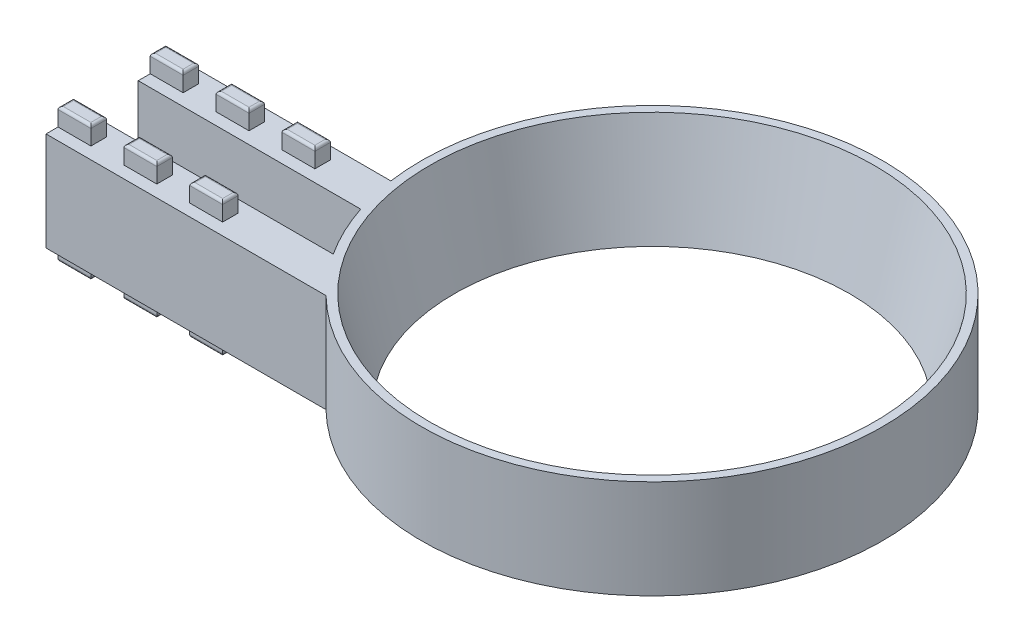
from build123d import *

# Parameters (mm, degrees)
SKETCH1_R            = 44.45
BOSS_EXTRUDE1_DEPTH  = 19.05
BOSS_EXTRUDE2_DEPTH  = 3.175
SKETCH4_W            = 53.981480267
SKETCH4_H            = 15.875
BOSS_EXTRUDE3_DEPTH  = 7.62
SKETCH5_W            = 53.981480267
SKETCH5_H            = 15.875
BOSS_EXTRUDE4_DEPTH  = 7.62
SKETCH2_R            = 38.1
CUT_EXTRUDE1_DEPTH   = 98.872432789
CUT_EXTRUDE1_DRAFT   = 14
SKETCH6_W            = 6.35
SKETCH6_H            = 2.9972
BOSS_EXTRUDE5_DEPTH  = 3.429
FILLET1_R            = 0.508
FILLET1_OF_MIRROR1_R = 0.508


with BuildPart() as part:
    # Sketch1 → Boss-Extrude1 (new body)
    with BuildSketch(Plane(origin=(0, 0, 0), x_dir=(1, 0, 0), z_dir=(0, 1, 0))):
        with Locations(Location((0, 0, 0), (0, 0, 90))):
            Circle(SKETCH1_R)
    extrude(amount=BOSS_EXTRUDE1_DEPTH)

    # Sketch3 → Boss-Extrude2 (add)
    with BuildSketch(Plane.XZ):
        with BuildLine():
            Line((-31.108519733, 31.75), (-85.09, 31.75))
            Line((-85.09, 31.75), (-85.09, 6.35))
            Line((-85.09, 6.35), (-43.994090512, 6.35))
            ThreePointArc((-43.994090512, 6.35), (-39.640768363, 20.109997105), (-31.108519733, 31.75))
        make_face()
    extrude(amount=-BOSS_EXTRUDE2_DEPTH)

    # Sketch4 → Boss-Extrude3 (add)
    with BuildSketch(Plane.XY.offset(31.75)):
        with Locations((-58.099259867, 11.1125)):
            Rectangle(SKETCH4_W, SKETCH4_H)
    extrude(amount=-BOSS_EXTRUDE3_DEPTH)

    # Sketch5 → Boss-Extrude4 (add)
    with BuildSketch(Plane(origin=(0, 0, 6.35), x_dir=(-1, 0, 0), z_dir=(0, 0, -1))):
        with Locations((58.099259867, 11.1125)):
            Rectangle(SKETCH5_W, SKETCH5_H)
    extrude(amount=-BOSS_EXTRUDE4_DEPTH)


with BuildPart() as cut_extrude1_tool:
    # Sketch2 → Cut-Extrude1 (with draft: the straight prism first)
    with BuildSketch(Plane.XZ):
        Circle(SKETCH2_R)
    extrude(amount=-CUT_EXTRUDE1_DEPTH)
    # Cut-Extrude1: the draft: its side faces are tilted about the plane it starts from
    cut_extrude1_sides = [cut_extrude1_tool.faces().sort_by_distance(p)[0] for p in [
        (-38.1, 49.436216394, 0),
    ]]
    draft(cut_extrude1_sides, Plane.XZ, CUT_EXTRUDE1_DRAFT)


with BuildPart() as part_1:
    add(part.part)

    # Cut-Extrude1: cut by cut_extrude1_tool
    add(cut_extrude1_tool.part, mode=Mode.SUBTRACT)

    # Sketch6 → Boss-Extrude5 (add)
    with BuildSketch(Plane(origin=(0, 19.05, 0), x_dir=(1, 0, 0), z_dir=(0, 1, 0))):
        with Locations((-81.915, -27.94)):
            Rectangle(SKETCH6_W, SKETCH6_H)
        with Locations((-69.215, -27.94)):
            Rectangle(SKETCH6_W, SKETCH6_H)
        with Locations((-56.515, -27.94)):
            Rectangle(SKETCH6_W, SKETCH6_H)
        with Locations((-56.515, -10.16)):
            Rectangle(SKETCH6_W, SKETCH6_H)
        with Locations((-69.215, -10.16)):
            Rectangle(SKETCH6_W, SKETCH6_H)
        with Locations((-81.915, -10.16)):
            Rectangle(SKETCH6_W, SKETCH6_H)
    boss_extrude5 = extrude(amount=BOSS_EXTRUDE5_DEPTH)

    # Fillet1
    fillet1_edges = [part_1.edges().sort_by_distance(p)[0] for p in [
        (-69.215, 22.479, 29.4386),
        (-66.04, 22.479, 27.94),
        (-69.215, 22.479, 26.4414),
        (-72.39, 22.479, 27.94),
        (-85.09, 22.479, 27.94),
        (-81.915, 22.479, 29.4386),
        (-78.74, 22.479, 27.94),
        (-81.915, 22.479, 26.4414),
        (-85.09, 22.479, 10.16),
        (-81.915, 22.479, 11.6586),
        (-78.74, 22.479, 10.16),
        (-81.915, 22.479, 8.6614),
        (-72.39, 22.479, 10.16),
        (-69.215, 22.479, 11.6586),
        (-66.04, 22.479, 10.16),
        (-69.215, 22.479, 8.6614),
        (-59.69, 22.479, 10.16),
        (-56.515, 22.479, 11.6586),
        (-53.34, 22.479, 10.16),
        (-56.515, 22.479, 8.6614),
        (-56.515, 22.479, 29.4386),
        (-53.34, 22.479, 27.94),
        (-56.515, 22.479, 26.4414),
        (-59.69, 22.479, 27.94),
    ]]
    fillet(fillet1_edges, radius=FILLET1_R)

    # Mirror1: Boss-Extrude5 across plane
    add(boss_extrude5.mirror(Plane.ZX.offset(9.525)))

    # Fillet1 of Mirror1
    fillet1_of_mirror1_edges = [part_1.edges().sort_by_distance(p)[0] for p in [
        (-69.215, -3.429, 29.4386),
        (-66.04, -3.429, 27.94),
        (-69.215, -3.429, 26.4414),
        (-72.39, -3.429, 27.94),
        (-85.09, -3.429, 27.94),
        (-81.915, -3.429, 29.4386),
        (-78.74, -3.429, 27.94),
        (-81.915, -3.429, 26.4414),
        (-85.09, -3.429, 10.16),
        (-81.915, -3.429, 11.6586),
        (-78.74, -3.429, 10.16),
        (-81.915, -3.429, 8.6614),
        (-72.39, -3.429, 10.16),
        (-69.215, -3.429, 11.6586),
        (-66.04, -3.429, 10.16),
        (-69.215, -3.429, 8.6614),
        (-59.69, -3.429, 10.16),
        (-56.515, -3.429, 11.6586),
        (-53.34, -3.429, 10.16),
        (-56.515, -3.429, 8.6614),
        (-56.515, -3.429, 29.4386),
        (-53.34, -3.429, 27.94),
        (-56.515, -3.429, 26.4414),
        (-59.69, -3.429, 27.94),
    ]]
    fillet(fillet1_of_mirror1_edges, radius=FILLET1_OF_MIRROR1_R)


solid = part_1.part
